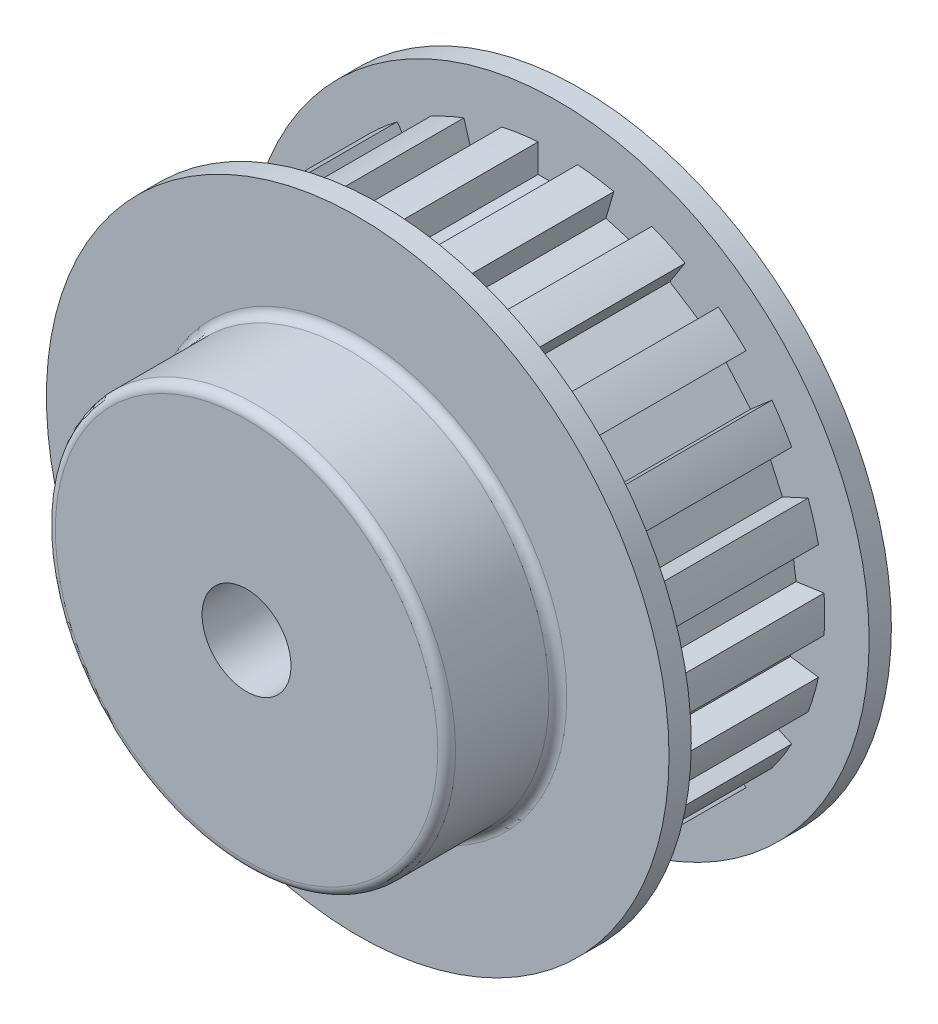
from build123d import *

# Parameters (mm, degrees)
SKETCH1_R           = 3.175
BOSS_EXTRUDE3_DEPTH = 6.35
SKETCH2_R           = 22.225
SKETCH2_R_2         = 3.175
BOSS_EXTRUDE4_DEPTH = 1.5875
SKETCH3_R           = 14.2875
SKETCH3_R_2         = 3.175
BOSS_EXTRUDE5_DEPTH = 7.9375
FILLET1_R           = 0.635


with BuildPart() as part:
    # Sketch1 → Boss-Extrude3 (new body)
    with BuildSketch(Plane.XY):
        with BuildLine():
            Line((3.998939094, 18.625546599), (3.431060125, 16.691528444))
            Line((3.431060125, 16.691528444), (6.137730131, 15.896778422))
            Line((6.137730131, 15.896778422), (6.705609099, 17.830796578))
            ThreePointArc((6.705609099, 17.830796578), (7.913655998, 17.328489512), (9.084376828, 16.744449756))
            Line((9.084376828, 16.744449756), (7.994625068, 15.048762919))
            Line((7.994625068, 15.048762919), (10.367748965, 13.523648797))
            Line((10.367748965, 13.523648797), (11.457500725, 15.219335634))
            ThreePointArc((11.457500725, 15.219335634), (12.475096982, 14.397029391), (13.433852379, 13.506817177))
            Line((13.433852379, 13.506817177), (11.910513034, 12.186836121))
            Line((11.910513034, 12.186836121), (13.757834437, 10.054913573))
            Line((13.757834437, 10.054913573), (15.281173782, 11.37489463))
            ThreePointArc((15.281173782, 11.37489463), (16.0258798, 10.299207573), (16.694997104, 9.174942598))
            Line((16.694997104, 9.174942598), (14.861482068, 8.337604338))
            Line((14.861482068, 8.337604338), (16.033341984, 5.771589051))
            Line((16.033341984, 5.771589051), (17.86685702, 6.608927312))
            ThreePointArc((17.86685702, 6.608927312), (18.278341147, 5.367005208), (18.603612453, 4.099768736))
            Line((18.603612453, 4.099768736), (16.60846221, 3.812909438))
            Line((16.60846221, 3.812909438), (17.009923518, 1.020684709))
            Line((17.009923518, 1.020684709), (19.005073761, 1.307544008))
            ThreePointArc((19.005073761, 1.307544008), (19.05, 0), (19.005073761, -1.307544008))
            Line((19.005073761, -1.307544008), (17.009923518, -1.020684709))
            Line((17.009923518, -1.020684709), (16.60846221, -3.812909438))
            Line((16.60846221, -3.812909438), (18.603612453, -4.099768736))
            ThreePointArc((18.603612453, -4.099768736), (18.278341147, -5.367005208), (17.86685702, -6.608927312))
            Line((17.86685702, -6.608927312), (16.033341984, -5.771589051))
            Line((16.033341984, -5.771589051), (14.861482068, -8.337604338))
            Line((14.861482068, -8.337604338), (16.694997104, -9.174942598))
            ThreePointArc((16.694997104, -9.174942598), (16.0258798, -10.299207573), (15.281173782, -11.37489463))
            Line((15.281173782, -11.37489463), (13.757834437, -10.054913573))
            Line((13.757834437, -10.054913573), (11.910513034, -12.186836121))
            Line((11.910513034, -12.186836121), (13.433852379, -13.506817177))
            ThreePointArc((13.433852379, -13.506817177), (12.475096982, -14.397029391), (11.457500725, -15.219335634))
            Line((11.457500725, -15.219335634), (10.367748965, -13.523648797))
            Line((10.367748965, -13.523648797), (7.994625068, -15.048762919))
            Line((7.994625068, -15.048762919), (9.084376828, -16.744449756))
            ThreePointArc((9.084376828, -16.744449756), (7.913655998, -17.328489512), (6.705609099, -17.830796578))
            Line((6.705609099, -17.830796578), (6.137730131, -15.896778422))
            Line((6.137730131, -15.896778422), (3.431060125, -16.691528444))
            Line((3.431060125, -16.691528444), (3.998939094, -18.625546599))
            ThreePointArc((3.998939094, -18.625546599), (2.711097669, -18.856098468), (1.410468904, -18.997712427))
            Line((1.410468904, -18.997712427), (1.410468904, -16.982045602))
            Line((1.410468904, -16.982045602), (-1.410468904, -16.982045602))
            Line((-1.410468904, -16.982045602), (-1.410468904, -18.997712427))
            ThreePointArc((-1.410468904, -18.997712427), (-2.711097669, -18.856098468), (-3.998939094, -18.625546599))
            Line((-3.998939094, -18.625546599), (-3.431060125, -16.691528444))
            Line((-3.431060125, -16.691528444), (-6.137730131, -15.896778422))
            Line((-6.137730131, -15.896778422), (-6.705609099, -17.830796578))
            ThreePointArc((-6.705609099, -17.830796578), (-7.913655998, -17.328489512), (-9.084376828, -16.744449756))
            Line((-9.084376828, -16.744449756), (-7.994625068, -15.048762919))
            Line((-7.994625068, -15.048762919), (-10.367748965, -13.523648797))
            Line((-10.367748965, -13.523648797), (-11.457500725, -15.219335634))
            ThreePointArc((-11.457500725, -15.219335634), (-12.475096982, -14.397029391), (-13.433852379, -13.506817177))
            Line((-13.433852379, -13.506817177), (-11.910513034, -12.186836121))
            Line((-11.910513034, -12.186836121), (-13.757834437, -10.054913573))
            Line((-13.757834437, -10.054913573), (-15.281173782, -11.37489463))
            ThreePointArc((-15.281173782, -11.37489463), (-16.0258798, -10.299207573), (-16.694997104, -9.174942598))
            Line((-16.694997104, -9.174942598), (-14.861482068, -8.337604338))
            Line((-14.861482068, -8.337604338), (-16.033341984, -5.771589051))
            Line((-16.033341984, -5.771589051), (-17.86685702, -6.608927312))
            ThreePointArc((-17.86685702, -6.608927312), (-18.278341147, -5.367005208), (-18.603612453, -4.099768736))
            Line((-18.603612453, -4.099768736), (-16.60846221, -3.812909438))
            Line((-16.60846221, -3.812909438), (-17.009923518, -1.020684709))
            Line((-17.009923518, -1.020684709), (-19.005073761, -1.307544008))
            ThreePointArc((-19.005073761, -1.307544008), (-19.05, 0), (-19.005073761, 1.307544008))
            Line((-19.005073761, 1.307544008), (-17.009923518, 1.020684709))
            Line((-17.009923518, 1.020684709), (-16.60846221, 3.812909438))
            Line((-16.60846221, 3.812909438), (-18.603612453, 4.099768736))
            ThreePointArc((-18.603612453, 4.099768736), (-18.278341147, 5.367005208), (-17.86685702, 6.608927312))
            Line((-17.86685702, 6.608927312), (-16.033341984, 5.771589051))
            Line((-16.033341984, 5.771589051), (-14.861482068, 8.337604338))
            Line((-14.861482068, 8.337604338), (-16.694997104, 9.174942598))
            ThreePointArc((-16.694997104, 9.174942598), (-16.0258798, 10.299207573), (-15.281173782, 11.37489463))
            Line((-15.281173782, 11.37489463), (-13.757834437, 10.054913573))
            Line((-13.757834437, 10.054913573), (-11.910513034, 12.186836121))
            Line((-11.910513034, 12.186836121), (-13.433852379, 13.506817177))
            ThreePointArc((-13.433852379, 13.506817177), (-12.475096982, 14.397029391), (-11.457500725, 15.219335634))
            Line((-11.457500725, 15.219335634), (-10.367748965, 13.523648797))
            Line((-10.367748965, 13.523648797), (-7.994625068, 15.048762919))
            Line((-7.994625068, 15.048762919), (-9.084376828, 16.744449756))
            ThreePointArc((-9.084376828, 16.744449756), (-7.913655998, 17.328489512), (-6.705609099, 17.830796578))
            Line((-6.705609099, 17.830796578), (-6.137730131, 15.896778422))
            Line((-6.137730131, 15.896778422), (-3.431060125, 16.691528444))
            Line((-3.431060125, 16.691528444), (-3.998939094, 18.625546599))
            ThreePointArc((-3.998939094, 18.625546599), (-2.711097669, 18.856098468), (-1.410468904, 18.997712427))
            Line((-1.410468904, 18.997712427), (-1.410468904, 16.982045602))
            Line((-1.410468904, 16.982045602), (1.410468904, 16.982045602))
            Line((1.410468904, 16.982045602), (1.410468904, 18.997712427))
            ThreePointArc((1.410468904, 18.997712427), (2.711097669, 18.856098468), (3.998939094, 18.625546599))
        make_face()
        Circle(SKETCH1_R, mode=Mode.SUBTRACT)
    boss_extrude3 = extrude(amount=BOSS_EXTRUDE3_DEPTH)

    # Sketch2 → Boss-Extrude4 (add)
    with BuildSketch(Plane.XY.offset(6.35)):
        Circle(SKETCH2_R)
        Circle(SKETCH2_R_2, mode=Mode.SUBTRACT)
    boss_extrude4 = extrude(amount=BOSS_EXTRUDE4_DEPTH)

    # Sketch3 → Boss-Extrude5 (add)
    with BuildSketch(Plane.XY.offset(7.9375)):
        Circle(SKETCH3_R)
        Circle(SKETCH3_R_2, mode=Mode.SUBTRACT)
    extrude(amount=BOSS_EXTRUDE5_DEPTH)

    # Fillet1
    fillet1_edges = [part.edges().sort_by_distance(p)[0] for p in [
        (-14.2875, 0, 7.9375),
        (-14.2875, 0, 15.875),
    ]]
    fillet(fillet1_edges, radius=FILLET1_R)

    # Mirror1: Boss-Extrude3, Boss-Extrude4 across plane
    add(boss_extrude3.mirror(Plane.XY))
    add(boss_extrude4.mirror(Plane.XY))


solid = part.part
